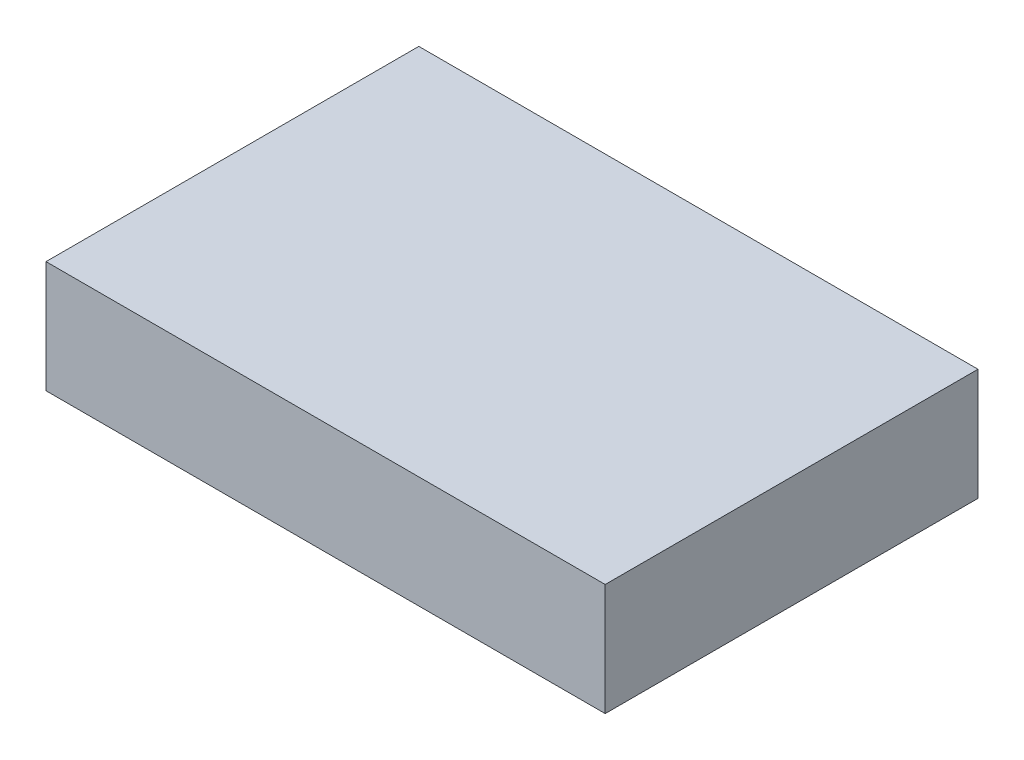
from build123d import *

# Parameters (mm, degrees)
SKETCH1_W      = 150
SKETCH1_H      = 30
EXTRUDE1_DEPTH = 100


with BuildPart() as part:
    # Sketch1 → Extrude1 (new body)
    with BuildSketch(Plane.XY):
        with Locations((75, 15)):
            Rectangle(SKETCH1_W, SKETCH1_H)
    extrude(amount=EXTRUDE1_DEPTH)


solid = part.part
